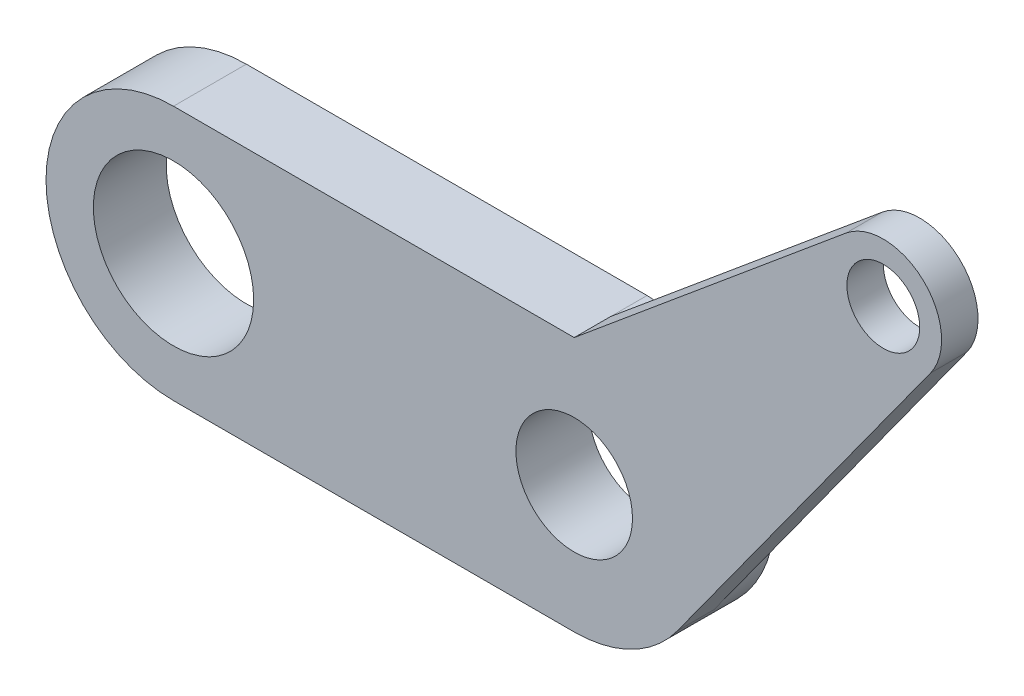
from build123d import *

# Parameters (mm, degrees)
SKETCH_1_R      = 11
SKETCH_1_R_2    = 8
EXTRUDE_1_DEPTH = 10
EXTRUDE_START   = -5
SKETCH_2_R      = 8
SKETCH_2_R_2    = 5
EXTRUDE_2_DEPTH = 5


with BuildPart() as part:
    # Эскиз1 → Бобышка-Вытянуть1 (new body)
    with BuildSketch(Plane.XY):
        with BuildLine():
            Line((-27.5, 17.5), (27.5, 17.5))
            ThreePointArc((27.5, 17.5), (45, 0), (27.5, -17.5))
            Line((27.5, -17.5), (-27.5, -17.5))
            ThreePointArc((-27.5, -17.5), (-45, 0), (-27.5, 17.5))
        make_face()
        with Locations((-27.5, 0)):
            Circle(SKETCH_1_R, mode=Mode.SUBTRACT)
        with Locations((27.5, 0)):
            Circle(SKETCH_1_R_2, mode=Mode.SUBTRACT)
    extrude(amount=EXTRUDE_1_DEPTH)

    # Эскиз2 → Бобышка-Вытянуть2 (add)
    # profile 1 of 2: a face of its own
    with BuildSketch(Plane.XY.offset(10).offset(EXTRUDE_START)):
        with BuildLine():
            ThreePointArc((27.5, 17.5), (43.084968678, 7.959821059), (41.677549931, -10.258999852))
            Line((41.677549931, -10.258999852), (76.407572554, 37.736578368))
            ThreePointArc((76.407572554, 37.736578368), (64.46541326, 36.580250119), (64.806416341, 48.573414027))
            Line((64.806416341, 48.573414027), (27.5, 17.5))
        make_face()
    # profile 2 of 2: a face of its own
    with BuildSketch(Plane.XY.offset(10).offset(EXTRUDE_START)):
        with Locations((69.926406871, 42.426406871)):
            Circle(SKETCH_2_R)
        with Locations((69.926406871, 42.426406871)):
            Circle(SKETCH_2_R_2, mode=Mode.SUBTRACT)
    extrude(amount=EXTRUDE_2_DEPTH)


solid = part.part
